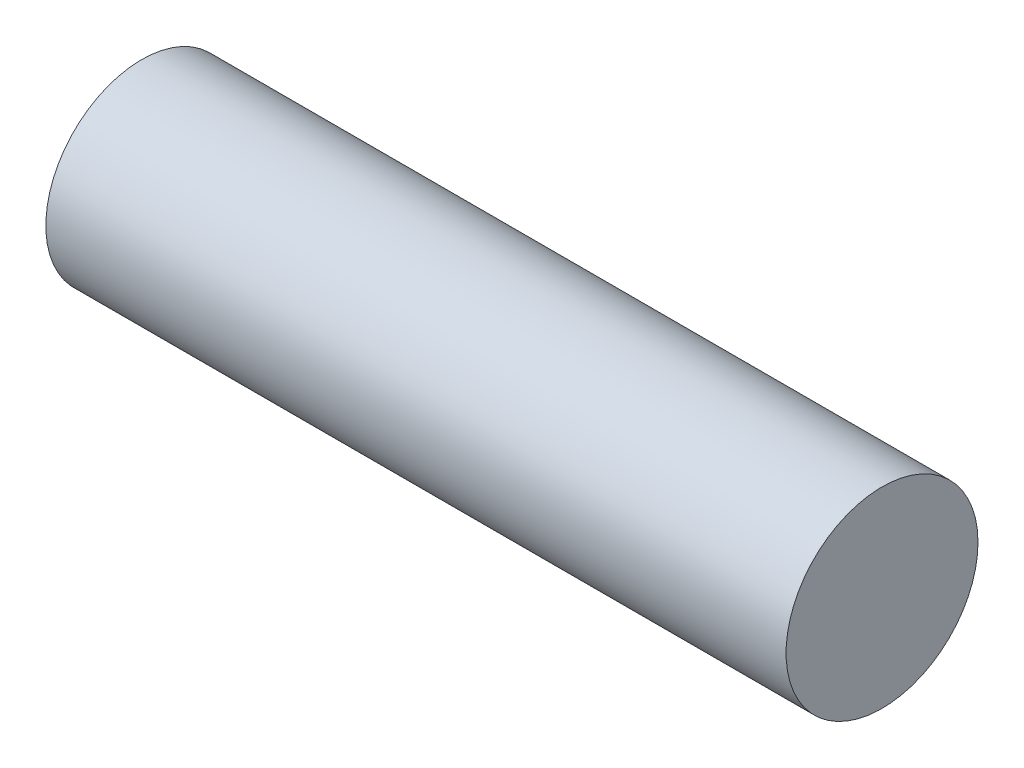
from build123d import *

# Parameters (mm, degrees)
SKETCH_1_R      = 3.5
EXTRUDE_1_DEPTH = 13.5


with BuildPart() as part:
    # 草图1 → 凸台-拉伸1 (new, symmetric)
    with BuildSketch(Plane(origin=(0, 0, 0), x_dir=(0, 0, -1), z_dir=(1, 0, 0))):
        Circle(SKETCH_1_R)
    extrude(amount=EXTRUDE_1_DEPTH, both=True)


solid = part.part
